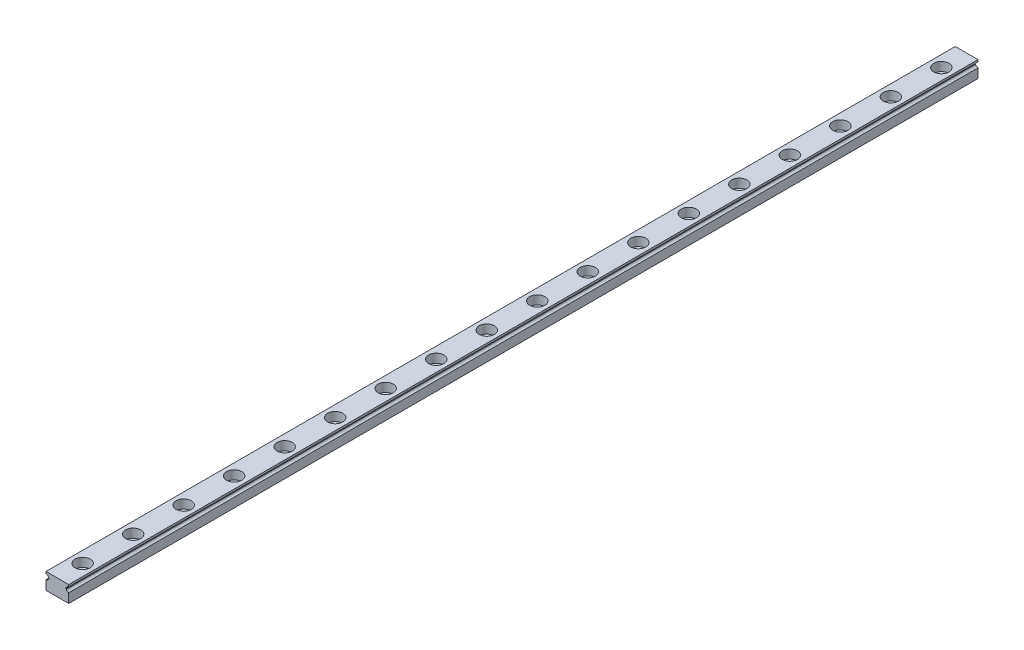
from build123d import *

# Parameters (mm, degrees)
EXTRUDE1_DEPTH  = 360
SKETCH2_R       = 3
EXTRUDE2_DEPTH  = 3.5
SKETCH_R        = 1.75
EXTRUDE3_DEPTH  = 361.086795093
LPATTERN1_COUNT = 40
LPATTERN1_PITCH = 20


with BuildPart() as part:
    # Sketch1 → Extrude1 (new body)
    with BuildSketch(Plane.XY):
        with BuildLine():
            Line((-4.5, -3.25), (4.5, -3.25))
            Line((4.5, -3.25), (4.5, 0.45))
            ThreePointArc((4.5, 0.45), (3.887627564, 0.659430585), (3.531754163, 1.2))
            Line((3.531754163, 1.2), (3.4, 1.2))
            Line((3.4, 1.2), (3.4, 1.7))
            Line((3.4, 1.7), (3.531754163, 1.7))
            ThreePointArc((3.531754163, 1.7), (3.887627564, 2.240569415), (4.5, 2.45))
            Line((4.5, 2.45), (4.5, 3.25))
            Line((4.5, 3.25), (-4.5, 3.25))
            Line((-4.5, 3.25), (-4.5, 2.45))
            ThreePointArc((-4.5, 2.45), (-3.887627564, 2.240569415), (-3.531754163, 1.7))
            Line((-3.531754163, 1.7), (-3.4, 1.7))
            Line((-3.4, 1.7), (-3.4, 1.2))
            Line((-3.4, 1.2), (-3.531754163, 1.2))
            ThreePointArc((-3.531754163, 1.2), (-3.887627564, 0.659430585), (-4.5, 0.45))
            Line((-4.5, 0.45), (-4.5, -3.25))
        make_face()
    extrude(amount=EXTRUDE1_DEPTH)

    # Sketch2 → Extrude2 (cut)
    with BuildSketch(Plane(origin=(0, 3.25, 0), x_dir=(1, 0, 0), z_dir=(0, 1, 0))):
        with Locations((0, -10)):
            Circle(SKETCH2_R)
    extrude2 = extrude(amount=-EXTRUDE2_DEPTH, mode=Mode.SUBTRACT)

    # Sketch → Extrude3 (cut, through all)
    with BuildSketch(Plane(origin=(0, 3.25, 0), x_dir=(1, 0, 0), z_dir=(0, 1, 0))):
        with Locations((0, -10)):
            Circle(SKETCH_R)
    extrude3 = extrude(amount=-EXTRUDE3_DEPTH, mode=Mode.SUBTRACT)

    # LPattern1: Extrude2, Extrude3 ×40
    with Locations(*[(0, 0, i * LPATTERN1_PITCH) for i in range(1, LPATTERN1_COUNT)]):
        add(extrude2, mode=Mode.SUBTRACT)
        add(extrude3, mode=Mode.SUBTRACT)


solid = part.part
